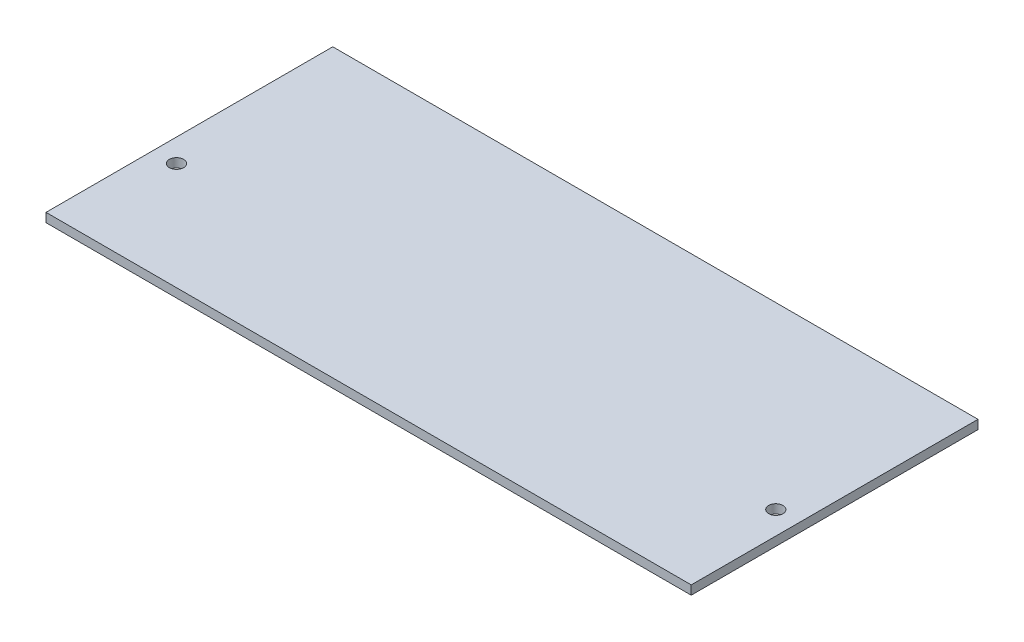
from build123d import *

# Parameters (mm, degrees)
SKETCH1_W           = 228.6
SKETCH1_H           = 101.6
BOSS_EXTRUDE1_DEPTH = 3.175
SKETCH2_R           = 2.54
CUT_EXTRUDE1_DEPTH  = 3.175


with BuildPart() as part:
    # Sketch1 → Boss-Extrude1 (new body)
    with BuildSketch(Plane(origin=(0, 0, 0), x_dir=(1, 0, 0), z_dir=(0, 1, 0))):
        with Locations((75.00964568, -6.4924035)):
            Rectangle(SKETCH1_W, SKETCH1_H)
    extrude(amount=BOSS_EXTRUDE1_DEPTH)

    # Sketch2 → Cut-Extrude1 (cut)
    with BuildSketch(Plane(origin=(0, 0, 0), x_dir=(-1, 0, 0), z_dir=(0, -1, 0))):
        with Locations(Location((31.16235432, -19.1924035, 0), (0, 0, 90))):
            Circle(SKETCH2_R)
        with Locations(Location((-181.18164568, -19.1924035, 0), (0, 0, 90))):
            Circle(SKETCH2_R)
    extrude(amount=-CUT_EXTRUDE1_DEPTH, mode=Mode.SUBTRACT)


solid = part.part
